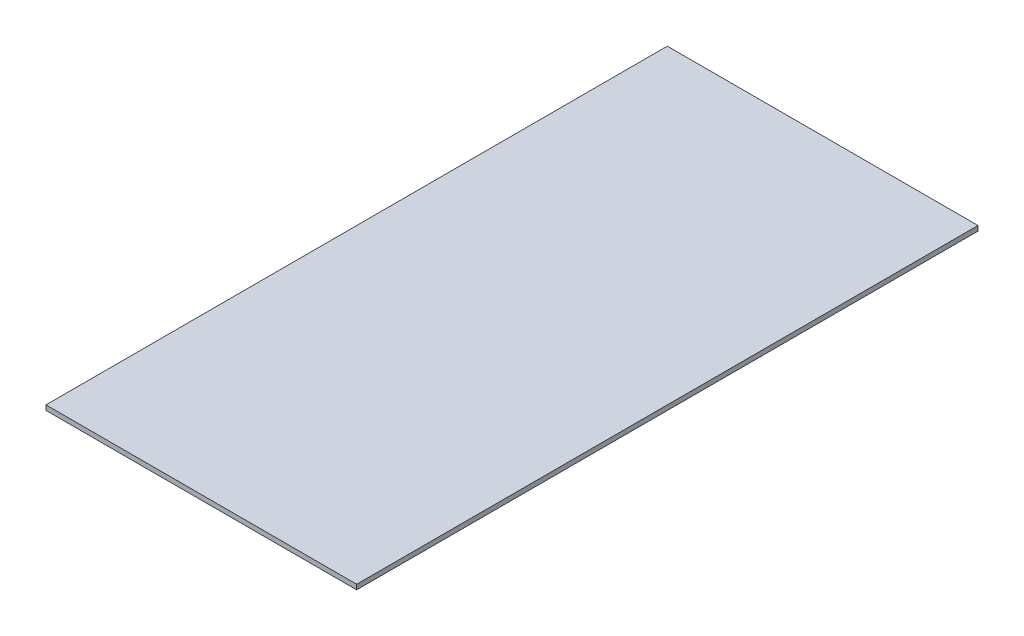
from build123d import *

# Parameters (mm, degrees)
SKETCH1_W      = 1219.2
SKETCH1_H      = 2438.4
EXTRUDE1_DEPTH = 19.05


with BuildPart() as part:
    # Sketch1 → Extrude1 (new body)
    with BuildSketch(Plane(origin=(0, 0, 0), x_dir=(1, 0, 0), z_dir=(0, 1, 0))):
        with Locations((0, 1219.2)):
            Rectangle(SKETCH1_W, SKETCH1_H)
    extrude(amount=-EXTRUDE1_DEPTH)


solid = part.part
